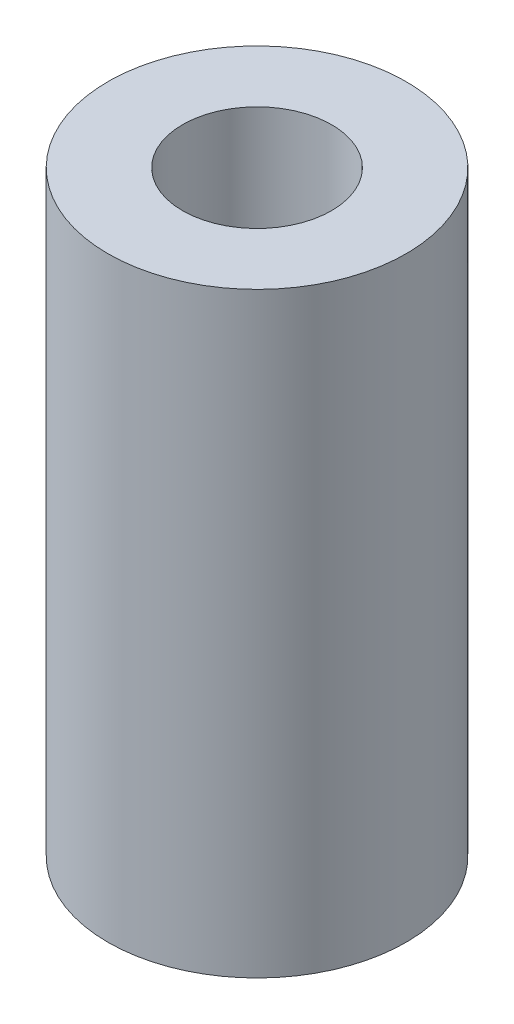
from build123d import *

# Parameters (mm, degrees)
SKETCH1_R           = 1.5875
SKETCH1_R_2         = 0.79375
BOSS_EXTRUDE1_DEPTH = 6.35


with BuildPart() as part:
    # Sketch1 → Boss-Extrude1 (new body)
    with BuildSketch(Plane(origin=(0, 0, 0), x_dir=(1, 0, 0), z_dir=(0, 1, 0))):
        with Locations(Location((0, 0, 0), (0, 0, 270))):
            Circle(SKETCH1_R)
        with Locations(Location((0, 0, 0), (0, 0, 270))):
            Circle(SKETCH1_R_2, mode=Mode.SUBTRACT)
    extrude(amount=BOSS_EXTRUDE1_DEPTH)


solid = part.part
